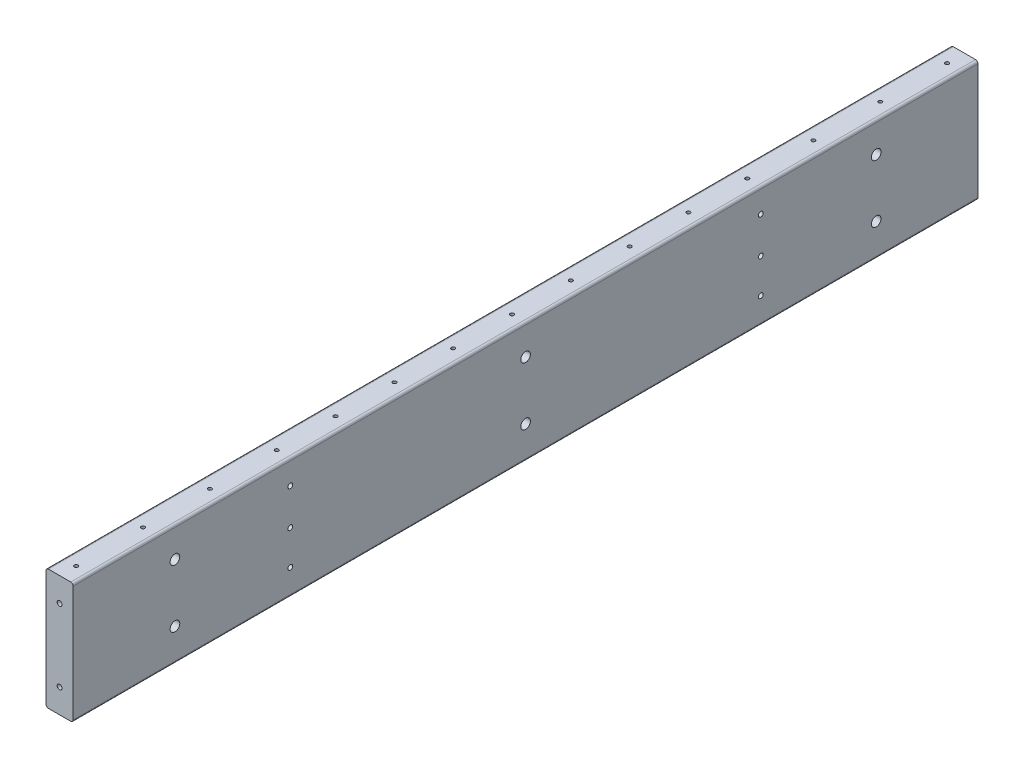
from build123d import *

# Parameters (mm, degrees)
SKETCH1_W                    = 200
SKETCH1_H                    = 1500
BOSS_EXTRUDE1_DEPTH          = 45
F_6_0_6_DIAMETER_HOLE1_D     = 6
F_6_0_6_DIAMETER_HOLE1_DEPTH = 16.197418143
F_6_0_6_DIAMETER_HOLE1_TIP   = 1.802581857
F_6_0_6_DIAMETER_HOLE2_D     = 6
F_6_0_6_DIAMETER_HOLE2_DEPTH = 16.197418143
F_6_0_6_DIAMETER_HOLE2_TIP   = 1.802581857
F_8_0_8_DIAMETER_HOLE1_D     = 8
F_16_0_16_DIAMETER_HOLE1_D   = 16
F_8_0_8_DIAMETER_HOLE2_D     = 8
F_8_0_8_DIAMETER_HOLE2_DEPTH = 1532.450071225
M33_CLEARANCE_HOLE1_D        = 36
M33_CLEARANCE_HOLE1_DEPTH    = 30
F_8_0_8_DIAMETER_HOLE3_D     = 8
F_8_0_8_DIAMETER_HOLE3_DEPTH = 1533.416876048
CHAMFER1_SIZE                = 0.025
FILLET1_R                    = 4


with BuildPart() as part:
    # Sketch1 → Boss-Extrude1 (new body)
    with BuildSketch(Plane(origin=(-31.188255411, 0, 0), x_dir=(0, -1, 0), z_dir=(-1, 0, 0))):
        with Locations((-34.272684877, 750)):
            Rectangle(SKETCH1_W, SKETCH1_H)
    extrude(amount=-BOSS_EXTRUDE1_DEPTH)

    # Ø6.0 (6) Diameter Hole1
    with Locations(Plane(origin=(0, 134.272684877, 0), x_dir=(1, 0, 0), z_dir=(0, 1, 0))):
        with Locations((-8.688255411, -750), (-8.688255411, -457.5), (-8.688255411, -555), (-8.688255411, -652.5), (-8.688255411, -847.5), (-8.688255411, -945), (-8.688255411, -1042.5), (-8.688255411, -139.629979152), (-8.688255411, -250.489979152), (-8.688255411, -1250.864924074), (-8.688255411, -1361.724924074), (-8.688255411, -28.769979152), (-8.688255411, -360), (-8.688255411, -1140), (-8.688255411, -1472.584924074)):
            Hole(F_6_0_6_DIAMETER_HOLE1_D / 2, depth=F_6_0_6_DIAMETER_HOLE1_DEPTH)
            with Locations((0, 0, -(F_6_0_6_DIAMETER_HOLE1_DEPTH + F_6_0_6_DIAMETER_HOLE1_TIP / 2))):  # 118° drill point
                Cone(0, F_6_0_6_DIAMETER_HOLE1_D / 2, F_6_0_6_DIAMETER_HOLE1_TIP, mode=Mode.SUBTRACT)

    # Ø6.0 (6) Diameter Hole2
    with Locations(Plane(origin=(0, -65.727315123, 0), x_dir=(-1, 0, 0), z_dir=(0, -1, 0))):
        with Locations((8.688255411, -750), (8.688255411, -457.5), (8.688255411, -555), (8.688255411, -652.5), (8.688255411, -847.5), (8.688255411, -945), (8.688255411, -1042.5), (8.688255411, -139.629979152), (8.688255411, -250.489979152), (8.688255411, -1250.864924074), (8.688255411, -1361.724924074), (8.688255411, -28.769979152), (8.688255411, -360), (8.688255411, -1140), (8.688255411, -1472.584924074)):
            Hole(F_6_0_6_DIAMETER_HOLE2_D / 2, depth=F_6_0_6_DIAMETER_HOLE2_DEPTH)
            with Locations((0, 0, -(F_6_0_6_DIAMETER_HOLE2_DEPTH + F_6_0_6_DIAMETER_HOLE2_TIP / 2))):  # 118° drill point
                Cone(0, F_6_0_6_DIAMETER_HOLE2_D / 2, F_6_0_6_DIAMETER_HOLE2_TIP, mode=Mode.SUBTRACT)

    # Ø8.0 (8) Diameter Hole1 (through all)
    with Locations(Plane.ZY.offset(31.188255411)):
        with Locations((1140, -22.727315123), (1140, 34.272684877), (1140, 94.272684877), (360, -22.727315123), (360, 34.272684877), (360, 94.272684877)):
            Hole(F_8_0_8_DIAMETER_HOLE1_D / 2)

    # Ø16.0 (16) Diameter Hole1 (through all)
    with Locations(Plane(origin=(13.811744589, 0, 0), x_dir=(0, 0, -1), z_dir=(1, 0, 0))):
        with Locations((-1331.25, -11.727315123), (-1331.25, 84.272684877), (-750, -11.727315123), (-750, 84.272684877), (-168.75, -11.727315123), (-168.75, 84.272684877)):
            Hole(F_16_0_16_DIAMETER_HOLE1_D / 2)

    # Ø8.0 (8) Diameter Hole2
    with Locations(Plane(origin=(0, 0, 0), x_dir=(-1, 0, 0), z_dir=(0, 0, -1))):
        with Locations((8.688255411, 94.272684877)):
            Hole(F_8_0_8_DIAMETER_HOLE2_D / 2, depth=F_8_0_8_DIAMETER_HOLE2_DEPTH)

    # M33 Clearance Hole1
    with Locations(Plane.ZY.offset(31.188255411)):
        with Locations((50, -22.727315123), (50, 94.272684877), (1450, -22.727315123), (1450, 94.272684877)):
            Hole(M33_CLEARANCE_HOLE1_D / 2, depth=M33_CLEARANCE_HOLE1_DEPTH)

    # Ø8.0 (8) Diameter Hole3
    with Locations(Plane(origin=(0, 0, 0), x_dir=(-1, 0, 0), z_dir=(0, 0, -1))):
        with Locations((8.688255411, -25.727315123)):
            Hole(F_8_0_8_DIAMETER_HOLE3_D / 2, depth=F_8_0_8_DIAMETER_HOLE3_DEPTH)

    # Chamfer1
    chamfer1_edges = [part.edges().sort_by_distance(p)[0] for p in [
        (-31.188255411, 94.272684877, 364),
        (-31.188255411, 34.272684877, 364),
        (-31.188255411, -22.727315123, 364),
        (-31.188255411, 94.272684877, 1144),
        (-31.188255411, 34.272684877, 1144),
        (-31.188255411, -22.727315123, 1144),
        (-12.688255411, 94.272684877, 1500),
        (-12.688255411, 94.272684877, 0),
        (-12.688255411, -25.727315123, 1500),
        (-12.688255411, -25.727315123, 0),
    ]]
    chamfer(chamfer1_edges, length=CHAMFER1_SIZE)

    # Fillet1
    fillet1_edges = [part.edges().sort_by_distance(p)[0] for p in [
        (13.811744589, -65.727315123, 750),
        (13.811744589, 134.272684877, 750),
        (-31.188255411, -65.727315123, 750),
        (-31.188255411, 134.272684877, 750),
    ]]
    fillet(fillet1_edges, radius=FILLET1_R)


solid = part.part
